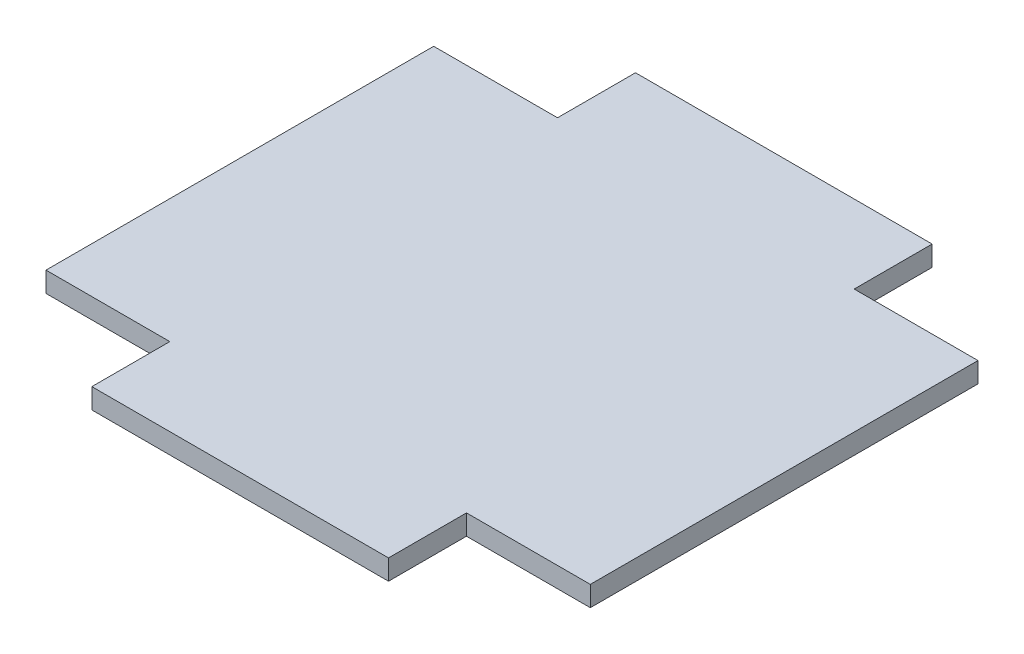
from build123d import *

# Parameters (mm, degrees)
BOSS_EXTRUDE1_DEPTH = 3


with BuildPart() as part:
    # Sketch1 → Boss-Extrude1 (new body)
    with BuildSketch(Plane(origin=(0, 0, 0), x_dir=(1, 0, 0), z_dir=(0, 1, 0))):
        Polygon((7.405241741, -46.164275874), (51.405241741, -46.164275874), (51.405241741, -34.599275874), (69.770241741, -34.599275874), (69.770241741, 22.900724126), (51.405241741, 22.900724126), (51.405241741, 34.465724126), (7.405241741, 34.465724126), (7.405241741, 22.900724126), (-10.959758259, 22.900724126), (-10.959758259, -34.599275874), (7.405241741, -34.599275874), align=None)
    extrude(amount=BOSS_EXTRUDE1_DEPTH)


solid = part.part
